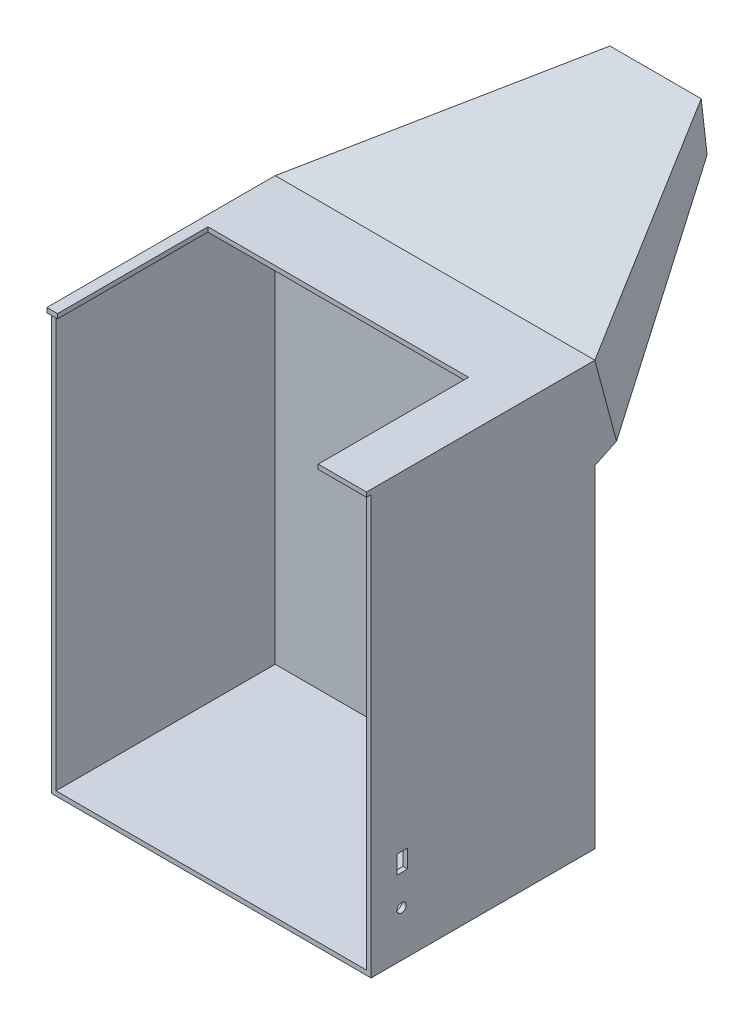
from build123d import *

# Parameters (mm, degrees)
SKETCH2_W           = 210
SKETCH2_H           = 150
BOSS_EXTRUDE3_DEPTH = 275
SKETCH5_W           = 204
SKETCH5_H           = 144
CUT_EXTRUDE1_DEPTH  = 272
SKETCH6_W           = 210
SKETCH6_H           = 275
CUT_EXTRUDE2_DEPTH  = 3
BOSS_EXTRUDE4_DEPTH = 3
BOSS_EXTRUDE6_DEPTH = 210
CUT_EXTRUDE3_DEPTH  = 210
SKETCH12_R          = 3
SKETCH12_W          = 7
SKETCH12_H          = 12
CUT_EXTRUDE4_DEPTH  = 26


with BuildPart() as part:
    # Sketch2 → Boss-Extrude3 (new body)
    with BuildSketch(Plane(origin=(0, 0, 0), x_dir=(1, 0, 0), z_dir=(0, 1, 0))):
        with Locations((49.81119073, 12.425134533)):
            Rectangle(SKETCH2_W, SKETCH2_H)
    extrude(amount=BOSS_EXTRUDE3_DEPTH)

    # Sketch5 → Cut-Extrude1 (cut)
    with BuildSketch(Plane(origin=(0, 275, 0), x_dir=(1, 0, 0), z_dir=(0, 1, 0))):
        with Locations((49.81119073, 12.425134533)):
            Rectangle(SKETCH5_W, SKETCH5_H)
    extrude(amount=-CUT_EXTRUDE1_DEPTH, mode=Mode.SUBTRACT)

    # Sketch6 → Cut-Extrude2 (cut)
    with BuildSketch(Plane.XY.offset(62.574865467)):
        with Locations((49.81119073, 137.5)):
            Rectangle(SKETCH6_W, SKETCH6_H)
    extrude(amount=-CUT_EXTRUDE2_DEPTH, mode=Mode.SUBTRACT)

    # Sketch8 → Boss-Extrude4 (add)
    with BuildSketch(Plane(origin=(0, 275, 0), x_dir=(1, 0, 0), z_dir=(0, 1, 0))):
        Polygon((154.81119073, -62.574865467), (123.063521966, -62.574865467), (123.063521966, 36.23081547), (-48.18880927, 36.23081547), (-48.18880927, -62.574865467), (-55.18880927, -62.574865467), (-55.18880927, 87.425134533), (154.81119073, 87.425134533), align=None)
    extrude(amount=BOSS_EXTRUDE4_DEPTH)

    # Sketch10 → Boss-Extrude6 (add)
    with BuildSketch(Plane(origin=(154.81119073, 0, 0), x_dir=(0, 0, -1), z_dir=(1, 0, 0))):
        Polygon((87.425134533, 278), (232.314008477, 316.822856765), (232.314008477, 286.822856765), (87.425134533, 218), align=None)
    extrude(amount=-BOSS_EXTRUDE6_DEPTH)

    # Sketch11 → Cut-Extrude3 (cut)
    with BuildSketch(Plane(origin=(0, 237.521247493, 63.643626451), x_dir=(-1, 0, 0), z_dir=(0, 0.9659258262890681, 0.25881904510252135))):
        Polygon((-19.81119073, -306.397889851), (55.18880927, -156.397889851), (55.18880927, -306.397889851), align=None)
        Polygon((-79.81119073, -306.397889851), (-154.81119073, -156.397889851), (-154.81119073, -306.397889851), align=None)
    extrude(amount=-CUT_EXTRUDE3_DEPTH, mode=Mode.SUBTRACT)

    # Sketch12 → Cut-Extrude4 (cut)
    with BuildSketch(Plane(origin=(154.81119073, 0, 0), x_dir=(0, 0, -1), z_dir=(1, 0, 0))):
        with Locations((-39.574865467, 30)):
            Circle(SKETCH12_R)
        with Locations((-39.074865467, 56)):
            Rectangle(SKETCH12_W, SKETCH12_H)
    extrude(amount=-CUT_EXTRUDE4_DEPTH, mode=Mode.SUBTRACT)


solid = part.part
